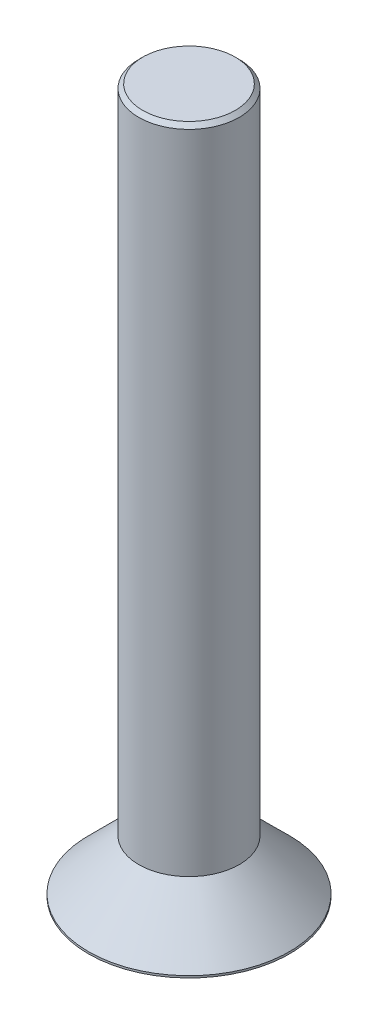
from build123d import *

# Parameters (mm, degrees)
SKETCH_1_R          = 5
EXTRUDE_1_DEPTH     = 2.6
CHAMFER_1_SIZE      = 2.5
CUT_EXTRUDE_1_DEPTH = 0.95
SKETCH_3_R          = 2.5
EXTRUDE_2_DEPTH     = 32.4
CHAMFER_2_SIZE      = 0.2


with BuildPart() as part:
    # 草图1 → 凸台-拉伸1 (new body)
    with BuildSketch(Plane(origin=(0, 0, 0), x_dir=(1, 0, 0), z_dir=(0, 1, 0))):
        with Locations(Location((0, 0, 0), (0, 0, 270))):
            Circle(SKETCH_1_R)
    extrude(amount=EXTRUDE_1_DEPTH)

    # 倒角1
    chamfer_1_edges = [part.edges().sort_by_distance(p)[0] for p in [
        (0, 2.6, -5),
    ]]
    chamfer(chamfer_1_edges, length=CHAMFER_1_SIZE)

    # 草图2 → 切除-拉伸1 (cut)
    with BuildSketch(Plane.XZ):
        Polygon((1.54, -0.889119415), (1.54, 0.889119415), (0, 1.778238829), (-1.54, 0.889119415), (-1.54, -0.889119415), (0, -1.778238829), align=None)
    extrude(amount=-CUT_EXTRUDE_1_DEPTH, mode=Mode.SUBTRACT)

    # 草图3 → 凸台-拉伸2 (add)
    with BuildSketch(Plane(origin=(0, 2.6, 0), x_dir=(1, 0, 0), z_dir=(0, 1, 0))):
        with Locations(Location((0, 0, 0), (0, 0, 270))):
            Circle(SKETCH_3_R)
    extrude(amount=EXTRUDE_2_DEPTH)

    # 倒角2
    chamfer_2_edges = [part.edges().sort_by_distance(p)[0] for p in [
        (0, 35, -2.5),
    ]]
    chamfer(chamfer_2_edges, length=CHAMFER_2_SIZE)


solid = part.part
